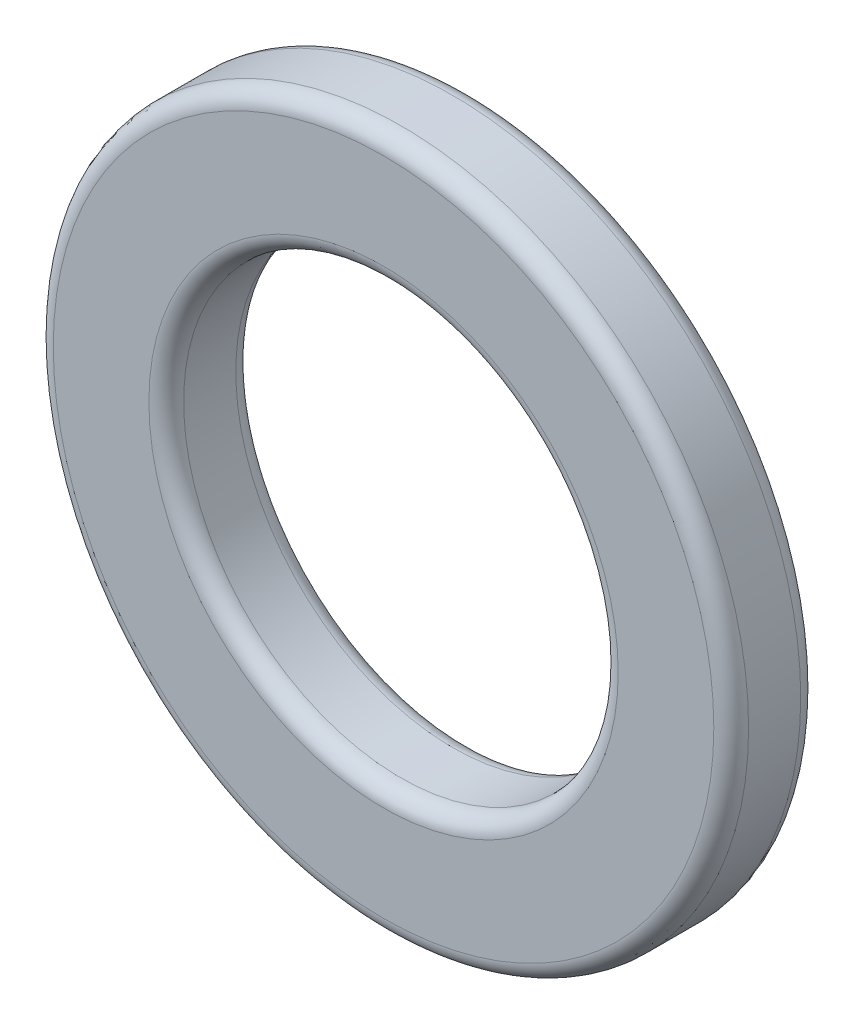
from build123d import *

# Parameters (mm, degrees)
SKETCH1_R           = 10.16
SKETCH1_R_2         = 6.35
BOSS_EXTRUDE1_DEPTH = 2.54
FILLET1_R           = 0.508


with BuildPart() as part:
    # Sketch1 → Boss-Extrude1 (new body)
    with BuildSketch(Plane.XY):
        Circle(SKETCH1_R)
        Circle(SKETCH1_R_2, mode=Mode.SUBTRACT)
    extrude(amount=BOSS_EXTRUDE1_DEPTH)

    # Fillet1
    fillet1_edges = [part.edges().sort_by_distance(p)[0] for p in [
        (-10.16, 0, 0),
        (-10.16, 0, 2.54),
        (-6.35, 0, 0),
        (-6.35, 0, 2.54),
    ]]
    fillet(fillet1_edges, radius=FILLET1_R)


solid = part.part
